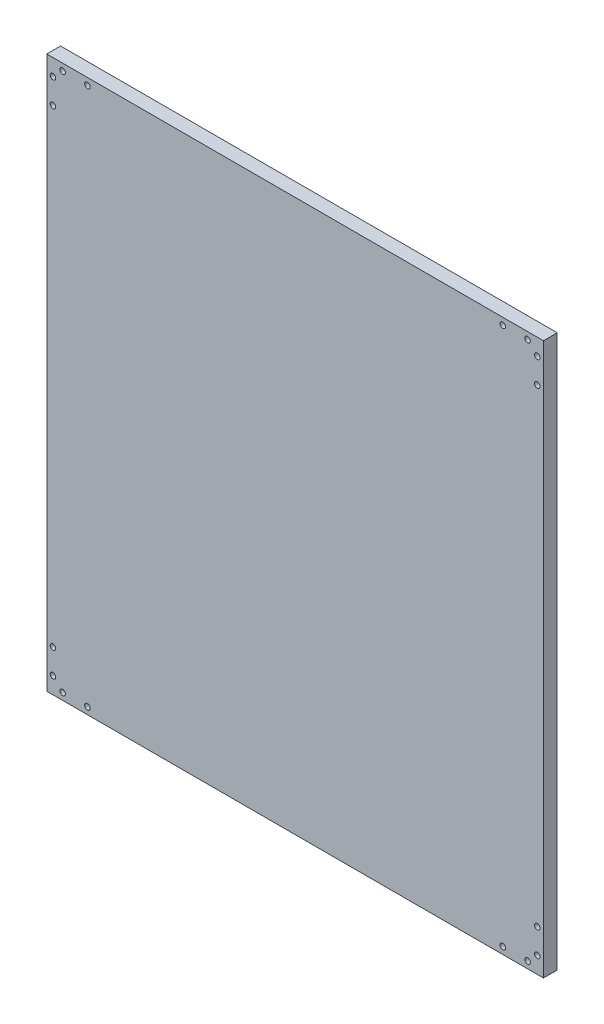
from build123d import *

# Parameters (mm, degrees)
SKETCH_1_W      = 360
SKETCH_1_H      = 400
SKETCH_1_R      = 2
EXTRUDE_1_DEPTH = 10


with BuildPart() as part:
    # Эскиз1 → Бобышка-Вытянуть1 (new body)
    with BuildSketch(Plane.XY):
        Rectangle(SKETCH_1_W, SKETCH_1_H)
        with Locations((150.5, 195)):
            Circle(SKETCH_1_R, mode=Mode.SUBTRACT)
        with Locations((168.5, 195)):
            Circle(SKETCH_1_R, mode=Mode.SUBTRACT)
        with Locations((175.5, 170)):
            Circle(SKETCH_1_R, mode=Mode.SUBTRACT)
        with Locations((175.5, 188)):
            Circle(SKETCH_1_R, mode=Mode.SUBTRACT)
        with Locations(Location((-150.5, 195, 0), (0, 0, 180))):
            Circle(SKETCH_1_R, mode=Mode.SUBTRACT)
        with Locations(Location((-168.5, 195, 0), (0, 0, 180))):
            Circle(SKETCH_1_R, mode=Mode.SUBTRACT)
        with Locations(Location((-175.5, 170, 0), (0, 0, 180))):
            Circle(SKETCH_1_R, mode=Mode.SUBTRACT)
        with Locations(Location((-175.5, 188, 0), (0, 0, 180))):
            Circle(SKETCH_1_R, mode=Mode.SUBTRACT)
        with Locations(Location((-150.5, -195, 0), (0, 0, 270))):
            Circle(SKETCH_1_R, mode=Mode.SUBTRACT)
        with Locations(Location((-168.5, -195, 0), (0, 0, 270))):
            Circle(SKETCH_1_R, mode=Mode.SUBTRACT)
        with Locations(Location((-175.5, -170, 0), (0, 0, 270))):
            Circle(SKETCH_1_R, mode=Mode.SUBTRACT)
        with Locations(Location((-175.5, -188, 0), (0, 0, 270))):
            Circle(SKETCH_1_R, mode=Mode.SUBTRACT)
        with Locations(Location((150.5, -195, 0), (0, 0, 90))):
            Circle(SKETCH_1_R, mode=Mode.SUBTRACT)
        with Locations(Location((168.5, -195, 0), (0, 0, 90))):
            Circle(SKETCH_1_R, mode=Mode.SUBTRACT)
        with Locations(Location((175.5, -170, 0), (0, 0, 90))):
            Circle(SKETCH_1_R, mode=Mode.SUBTRACT)
        with Locations(Location((175.5, -188, 0), (0, 0, 90))):
            Circle(SKETCH_1_R, mode=Mode.SUBTRACT)
    extrude(amount=EXTRUDE_1_DEPTH)


solid = part.part
